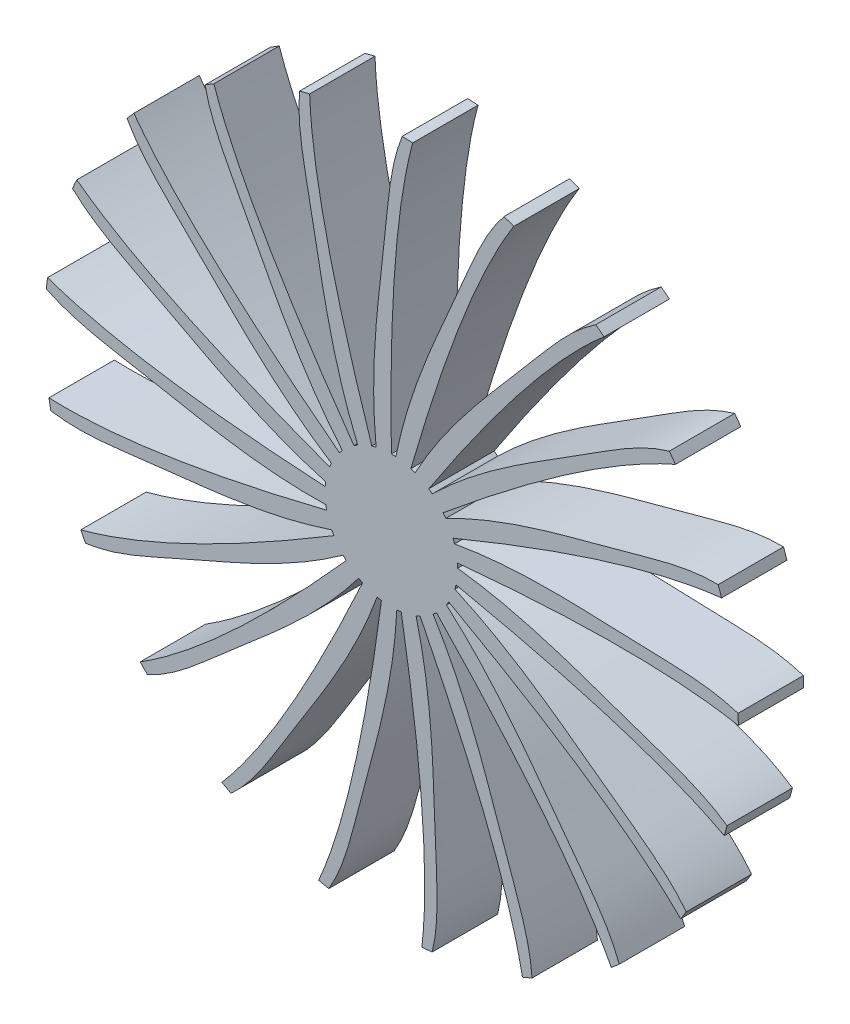
from build123d import *

# Parameters (mm, degrees)
BOSS_EXTRUDE1_DEPTH = 30


with BuildPart() as part:
    # Sketch1 → Boss-Extrude1 (new body)
    with BuildSketch(Plane.XY):
        with BuildLine():
            ThreePointArc((9.784959386, 158.947312113), (7.393315909, 159.076498384), (5, 159.169700189))
            add(Edge.make_bspline(
                [(-7, 29.619392864), (-9.692429703, 56.720975211), (-6.62249058, 83.790399811), (-1.67951765, 126.629684841), (-0.334655964, 146.134645097), (5, 159.169700189)],
                knots=[0, 0, 0, 0, 0.569376498, 0.669376498, 1, 1, 1, 1], degree=3))
            ThreePointArc((-7, 29.619392864), (-7.989983177, 29.367815759), (-8.970966748, 29.083159891))
            add(Edge.make_bspline(
                [(-8.970966748, 29.083159891), (-36.009715719, 111.249145083), (-37.500301609, 154.769896419)],
                knots=[0, 0, 0, 1, 1, 1], degree=2))
            ThreePointArc((-37.500301609, 154.769896419), (-39.823769399, 154.188394016), (-42.138228711, 153.572012878))
            add(Edge.make_bspline(
                [(-15.41947895, 26.240200124), (-25.980623187, 51.344127622), (-31.025925815, 78.115814079), (-38.929656234, 120.508836721), (-43.393730941, 139.543651261), (-42.138228711, 153.572012878)],
                knots=[0, 0, 0, 0, 0.569376498, 0.669376498, 1, 1, 1, 1], degree=3))
            ThreePointArc((-15.41947895, 26.240200124), (-16.291326299, 25.70799722), (-17.144823732, 25.14683783))
            add(Edge.make_bspline(
                [(-17.144823732, 25.14683783), (-67.201166248, 95.692607671), (-81.453496239, 136.840496231)],
                knots=[0, 0, 0, 1, 1, 1], degree=2))
            ThreePointArc((-81.453496239, 136.840496231), (-83.502338032, 135.599974194), (-85.532290881, 134.328778283))
            add(Edge.make_bspline(
                [(-22.468869528, 20.52945045), (-39.960324287, 41.405128973), (-52.672571386, 65.500295461), (-72.720724021, 103.680249615), (-82.597082494, 120.553591633), (-85.532290881, 134.328778283)],
                knots=[0, 0, 0, 0, 0.569376498, 0.669376498, 1, 1, 1, 1], degree=3))
            ThreePointArc((-22.468869528, 20.52945045), (-23.145113586, 19.76391031), (-23.795287889, 18.976108872))
            add(Edge.make_bspline(
                [(-23.795287889, 18.976108872), (-92.421498247, 71.633362127), (-118.169190275, 106.752217438)],
                knots=[0, 0, 0, 1, 1, 1], degree=2))
            ThreePointArc((-118.169190275, 106.752217438), (-119.761357486, 104.962901595), (-121.326433653, 103.149842245))
            add(Edge.make_bspline(
                [(-27.521802446, 12.994569011), (-50.389375211, 27.787102912), (-69.63902784, 47.064788148), (-100.05023635, 77.639217337), (-114.461320797, 90.851816348), (-121.326433653, 103.149842245)],
                knots=[0, 0, 0, 0, 0.569376498, 0.669376498, 1, 1, 1, 1], degree=3))
            ThreePointArc((-27.521802446, 12.994569011), (-27.94235596, 12.063713237), (-28.331436293, 11.119269366))
            add(Edge.make_bspline(
                [(-28.331436293, 11.119269366), (-109.429774542, 41.209178001), (-144.385033178, 67.178535652)],
                knots=[0, 0, 0, 1, 1, 1], degree=2))
            ThreePointArc((-144.385033178, 67.178535652), (-145.379054764, 64.999414567), (-146.340190364, 62.805590058))
            add(Edge.make_bspline(
                [(-30.129302439, 4.30506309), (-56.341109017, 11.700070816), (-80.417751065, 24.447367867), (-118.489846116, 44.699599885), (-136.155168441, 53.077458484), (-146.340190364, 62.805590058)],
                knots=[0, 0, 0, 0, 0.569376498, 0.669376498, 1, 1, 1, 1], degree=3))
            ThreePointArc((-30.129302439, 4.30506309), (-30.256797384, 3.291602301), (-30.350212251, 2.274433981))
            add(Edge.make_bspline(
                [(-30.350212251, 2.274433981), (-116.714735145, 7.123377565), (-157.77163226, 21.635746165)],
                knots=[0, 0, 0, 1, 1, 1], degree=2))
            ThreePointArc((-157.77163226, 21.635746165), (-158.079185041, 19.26044431), (-158.350978957, 16.880785577))
            add(Edge.make_bspline(
                [(-30.059681689, -4.76696658), (-57.286688039, -5.426563918), (-84.0510042, -0.342308334), (-126.40111307, 7.788226821), (-145.751031862, 10.586935507), (-158.350978957, 16.880785577)],
                knots=[0, 0, 0, 0, 0.569376498, 0.669376498, 1, 1, 1, 1], degree=3))
            ThreePointArc((-30.059681689, -4.76696658), (-29.882789581, -5.772981943), (-29.672238662, -6.772494845))
            add(Edge.make_bspline(
                [(-29.672238662, -6.772494845), (-113.629079336, -27.595366227), (-157.139529447, -25.829474316)],
                knots=[0, 0, 0, 1, 1, 1], degree=2))
            ThreePointArc((-157.139529447, -25.829474316), (-156.733286008, -28.189900948), (-156.291588158, -30.543950783))
            add(Edge.make_bspline(
                [(-27.319126307, -13.415430349), (-53.142093429, -22.071024633), (-80.21595676, -25.101568937), (-123.081086426, -29.815164373), (-142.396276484, -32.84428315), (-156.291588158, -30.543950783)],
                knots=[0, 0, 0, 0, 0.569376498, 0.669376498, 1, 1, 1, 1], degree=3))
            ThreePointArc((-27.319126307, -13.415430349), (-26.853564785, -14.324611408), (-26.357756453, -15.217657783))
            add(Edge.make_bspline(
                [(-26.357756453, -15.217657783), (-100.446981175, -59.86214063), (-142.544889846, -70.999632653)],
                knots=[0, 0, 0, 1, 1, 1], degree=2))
            ThreePointArc((-142.544889846, -70.999632653), (-141.4609467, -73.135449797), (-140.345003876, -75.254723076))
            add(Edge.make_bspline(
                [(-22.151146665, -20.871874259), (-44.275590609, -36.754377952), (-69.25336954, -47.630444984), (-108.824765121, -64.769347371), (-126.388987045, -73.357143114), (-140.345003876, -75.254723076)],
                knots=[0, 0, 0, 0, 0.569376498, 0.669376498, 1, 1, 1, 1], degree=3))
            ThreePointArc((-22.151146665, -20.871874259), (-21.438282913, -21.603436287), (-20.701271914, -22.310665046))
            add(Edge.make_bspline(
                [(-20.701271914, -22.310665046), (-78.339727932, -86.809901138), (-115.284511235, -109.861162052)],
                knots=[0, 0, 0, 1, 1, 1], degree=2))
            ThreePointArc((-115.284511235, -109.861162052), (-113.619181487, -111.582592982), (-111.928150107, -113.278782973))
            add(Edge.make_bspline(
                [(-15.014940433, -26.473760546), (-31.475007262, -48.171943497), (-52.137316523, -65.927146972), (-84.898885864, -93.96848962), (-99.151481458, -107.351898991), (-111.928150107, -113.278782973)],
                knots=[0, 0, 0, 0, 0.569376498, 0.669376498, 1, 1, 1, 1], degree=3))
            ThreePointArc((-15.014940433, -26.473760546), (-14.118115524, -26.962701046), (-13.205388519, -27.42127181))
            add(Edge.make_bspline(
                [(-13.205388519, -27.42127181), (-49.271646074, -106.04422097), (-77.780597883, -138.961045085)],
                knots=[0, 0, 0, 1, 1, 1], degree=2))
            ThreePointArc((-77.780597883, -138.961045085), (-75.681853389, -140.115133108), (-73.565989012, -141.237525888))
            add(Edge.make_bspline(
                [(-6.544590851, -29.723337031), (-15.877731394, -55.309220463), (-30.388634132, -78.365932634), (-53.429368027, -114.818119192), (-63.103931625, -131.807967535), (-73.565989012, -141.237525888)],
                knots=[0, 0, 0, 0, 0.569376498, 0.669376498, 1, 1, 1, 1], degree=3))
            ThreePointArc((-6.544590851, -29.723337031), (-5.543491614, -29.926211494), (-4.536148404, -30.095378238))
            add(Edge.make_bspline(
                [(-4.536148404, -30.095378238), (-15.825562237, -115.856046402), (-33.365537075, -155.713629442)],
                knots=[0, 0, 0, 1, 1, 1], degree=2))
            ThreePointArc((-33.365537075, -155.713629442), (-31.019860493, -156.197828772), (-28.667166954, -156.646694817))
            add(Edge.make_bspline(
                [(2.507274348, -30.331864581), (1.130350586, -57.53203047), (-5.93978824, -83.841561279), (-17.212416369, -125.465655002), (-21.449320539, -144.552319735), (-28.667166954, -156.646694817)],
                knots=[0, 0, 0, 0, 0.569376498, 0.669376498, 1, 1, 1, 1], degree=3))
            ThreePointArc((2.507274348, -30.331864581), (3.523695853, -30.230646721), (4.536148404, -30.095378238))
            add(Edge.make_bspline(
                [(4.536148404, -30.095378238), (19.026692254, -115.373553685), (14.014198125, -158.630374485)],
                knots=[0, 0, 0, 1, 1, 1], degree=2))
            ThreePointArc((14.014198125, -158.630374485), (16.398383136, -158.401661888), (18.778858692, -158.137117479))
            add(Edge.make_bspline(
                [(11.336357219, -28.245272855), (18.037995956, -54.642867094), (19.036833904, -81.867499271), (20.533934019, -124.965016769), (22.111156805, -144.452563968), (18.778858692, -158.137117479)],
                knots=[0, 0, 0, 0, 0.569376498, 0.669376498, 1, 1, 1, 1], degree=3))
            ThreePointArc((11.336357219, -28.245272855), (12.27778748, -27.848956322), (13.205388519, -27.42127181))
            add(Edge.make_bspline(
                [(13.205388519, -27.42127181), (52.18834164, -104.639614414), (60.148710322, -147.452114616)],
                knots=[0, 0, 0, 1, 1, 1], degree=2))
            ThreePointArc((60.148710322, -147.452114616), (62.35955846, -146.53081221), (64.556300333, -145.576363279))
            add(Edge.make_bspline(
                [(19.158155002, -23.648964683), (33.342886227, -46.898445181), (42.321949813, -72.619150684), (56.455754257, -113.360688396), (63.706960834, -131.517563974), (64.556300333, -145.576363279)],
                knots=[0, 0, 0, 0, 0.569376498, 0.669376498, 1, 1, 1, 1], degree=3))
            ThreePointArc((19.158155002, -23.648964683), (19.940943809, -22.992763941), (20.701271914, -22.310665046))
            add(Edge.make_bspline(
                [(20.701271914, -22.310665046), (80.712827847, -84.6079862), (100.938745647, -123.172087282)],
                knots=[0, 0, 0, 1, 1, 1], degree=2))
            ThreePointArc((100.938745647, -123.172087282), (102.779813355, -121.640056827), (104.597631389, -120.080510351))
            add(Edge.make_bspline(
                [(25.277666638, -16.951342217), (45.685114734, -34.986890604), (61.846574754, -56.918271874), (87.361232978, -91.683765384), (99.642121819, -106.896651265), (104.597631389, -120.080510351)],
                knots=[0, 0, 0, 0, 0.569376498, 0.669376498, 1, 1, 1, 1], degree=3))
            ThreePointArc((25.277666638, -16.951342217), (25.832259771, -16.093563582), (26.357756453, -15.217657783))
            add(Edge.make_bspline(
                [(26.357756453, -15.217657783), (102.065625098, -57.058567115), (132.75993046, -87.94767946)],
                knots=[0, 0, 0, 1, 1, 1], degree=2))
            ThreePointArc((132.75993046, -87.94767946), (134.067630791, -85.941048587), (135.345003876, -83.914977113))
            add(Edge.make_bspline(
                [(29.151146665, -8.747518606), (53.968020311, -19.966597258), (75.87586012, -36.159954827), (110.50428277, -61.86033747), (126.723643009, -72.777501983), (135.345003876, -83.914977113)],
                knots=[0, 0, 0, 0, 0.569376498, 0.669376498, 1, 1, 1, 1], degree=3))
            ThreePointArc((29.151146665, -8.747518606), (29.42826609, -7.764379473), (29.672238662, -6.772494845))
            add(Edge.make_bspline(
                [(29.672238662, -6.772494845), (114.349443651, -24.439243946), (152.784812844, -44.908734367)],
                knots=[0, 0, 0, 1, 1, 1], degree=2))
            ThreePointArc((152.784812844, -44.908734367), (153.442950886, -42.605801034), (154.066378818, -40.293229904))
            add(Edge.make_bspline(
                [(30.434419383, 0.233560422), (57.455630449, -3.172184125), (83.163242338, -12.188667108), (123.828542098, -26.540347102), (142.545212399, -32.191752271), (154.066378818, -40.293229904)],
                knots=[0, 0, 0, 0, 0.569376498, 0.669376498, 1, 1, 1, 1], degree=3))
            ThreePointArc((30.434419383, 0.233560422), (30.409441822, 1.254703826), (30.350212251, 2.274433981))
            add(Edge.make_bspline(
                [(30.350212251, 2.274433981), (116.472812321, 10.351613299), (159.234094122, 2.120548854)],
                knots=[0, 0, 0, 1, 1, 1], degree=2))
            ThreePointArc((159.234094122, 2.120548854), (159.184191421, 4.515158914), (159.098279892, 6.908747605))
            add(Edge.make_bspline(
                [(29.013460379, 9.193886581), (55.838055681, 13.904091489), (83.061205518, 12.865637173), (126.150092048, 11.137869577), (145.701014119, 11.254375902), (159.098279892, 6.908747605)],
                knots=[0, 0, 0, 0, 0.569376498, 0.669376498, 1, 1, 1, 1], degree=3))
            ThreePointArc((29.013460379, 9.193886581), (28.688605199, 10.162301184), (28.331436293, 11.119269366))
            add(Edge.make_bspline(
                [(28.331436293, 11.119269366), (108.247060484, 44.222684274), (151.534727349, 48.961412003)],
                knots=[0, 0, 0, 1, 1, 1], degree=2))
            ThreePointArc((151.534727349, 48.961412003), (150.781217979, 51.234927177), (149.993600607, 53.496852572))
            add(Edge.make_bspline(
                [(25.014528097, 17.337295571), (49.259024625, 29.744927557), (75.57881608, 36.776773131), (117.262652719, 47.826437665), (135.910641336, 53.700503386), (149.993600607, 53.496852572)],
                knots=[0, 0, 0, 0, 0.569376498, 0.669376498, 1, 1, 1, 1], degree=3))
            ThreePointArc((25.014528097, 17.337295571), (24.418660107, 18.166933484), (23.795287889, 18.976108872))
            add(Edge.make_bspline(
                [(23.795287889, 18.976108872), (90.403082289, 74.164375684), (130.370835053, 91.451838833)],
                knots=[0, 0, 0, 1, 1, 1], degree=2))
            ThreePointArc((130.370835053, 91.451838833), (128.980671628, 93.40224732), (127.561331672, 95.33152742))
            add(Edge.make_bspline(
                [(18.79294522, 23.940209765), (38.303113061, 42.942796279), (61.380917161, 57.420131404), (97.955912097, 80.265416885), (114.044011636, 91.375105484), (127.561331672, 95.33152742)],
                knots=[0, 0, 0, 0, 0.569376498, 0.669376498, 1, 1, 1, 1], degree=3))
            ThreePointArc((18.79294522, 23.940209765), (17.979009904, 24.557354021), (17.144823732, 25.14683783))
            add(Edge.make_bspline(
                [(17.144823732, 25.14683783), (64.526393505, 97.516236849), (97.622921939, 125.816368452)],
                knots=[0, 0, 0, 1, 1, 1], degree=2))
            ThreePointArc((97.622921939, 125.816368452), (95.719626581, 127.2703679), (93.794678624, 128.695577702))
            add(Edge.make_bspline(
                [(10.901526688, 28.415931262), (23.943801811, 52.325009099), (41.729054387, 72.961459017), (69.945358813, 105.572461575), (82.044071028, 120.930628467), (93.794678624, 128.695577702)],
                knots=[0, 0, 0, 0, 0.569376498, 0.669376498, 1, 1, 1, 1], degree=3))
            ThreePointArc((10.901526688, 28.415931262), (9.941845772, 28.765745884), (8.970966748, 29.083159891))
            add(Edge.make_bspline(
                [(8.970966748, 29.083159891), (32.916251488, 112.203352427), (56.200783799, 149.001561598)],
                knots=[0, 0, 0, 1, 1, 1], degree=2))
            ThreePointArc((56.200783799, 149.001561598), (53.953472653, 149.829957775), (51.693956769, 150.624461134))
            add(Edge.make_bspline(
                [(2.041459669, 30.366772566), (7.456978695, 57.057915237), (18.369382005, 82.019840811), (35.719853448, 121.498929757), (42.754154665, 139.740934415), (51.693956769, 150.624461134)],
                knots=[0, 0, 0, 0, 0.569376498, 0.669376498, 1, 1, 1, 1], degree=3))
            ThreePointArc((2.041459669, 30.366772566), (1.021305014, 30.41817499), (0, 30.435315567))
            add(Edge.make_bspline(
                [(0, 30.435315567), (-1.618643923, 116.920707746), (9.784959386, 158.947312113)],
                knots=[0, 0, 0, 1, 1, 1], degree=2))
        make_face()
    extrude(amount=-BOSS_EXTRUDE1_DEPTH)


solid = part.part
